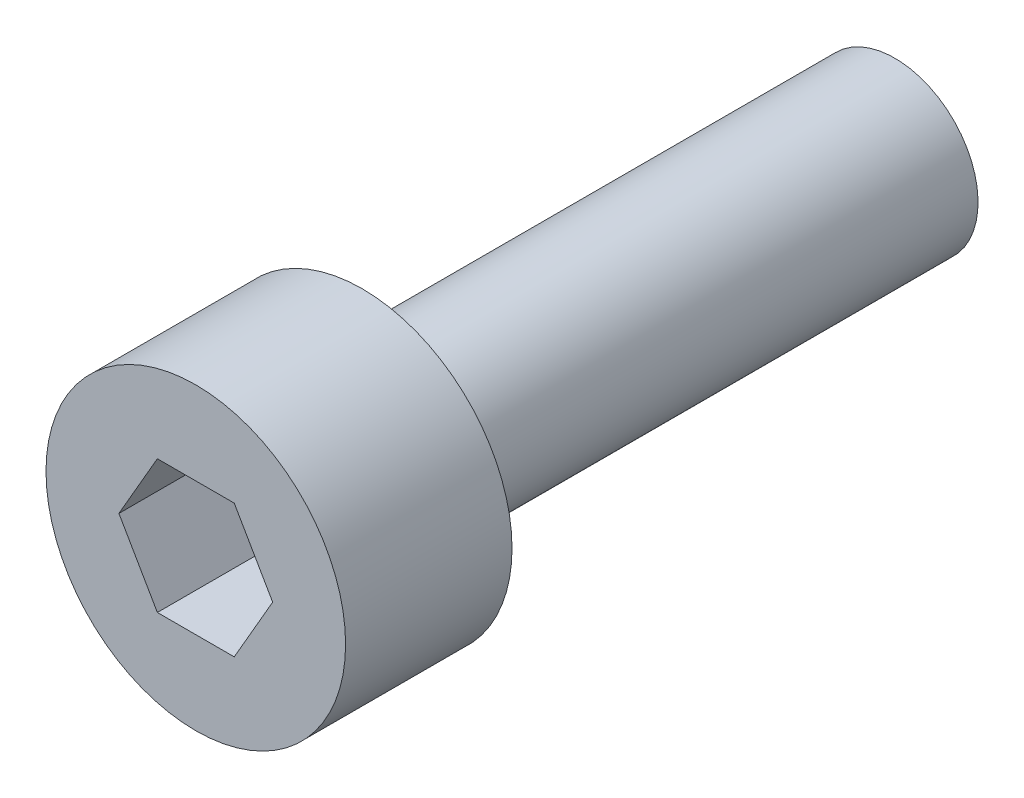
from build123d import *

# Parameters (mm, degrees)
CUT_EXTRUDE1_DEPTH = 1.5


with BuildPart() as part:
    # Sketch1 → Revolve1 (revolve)
    with BuildSketch(Plane(origin=(0, 0, 0), x_dir=(0, 0, -1), z_dir=(1, 0, 0))):
        Polygon((-2.5, 0), (-2.5, 2.25), (0, 2.25), (0, 1.25), (8, 1.25), (8, 0), align=None)
    revolve(axis=Axis((0, 0, 5.584882278), (0, 0, -1)))

    # Sketch2 → Cut-Extrude1 (cut)
    with BuildSketch(Plane.XY.offset(2.5)):
        Polygon((0.577350269, -1), (1.154700538, 0), (0.577350269, 1), (-0.577350269, 1), (-1.154700538, 0), (-0.577350269, -1), align=None)
    extrude(amount=-CUT_EXTRUDE1_DEPTH, mode=Mode.SUBTRACT)


solid = part.part
